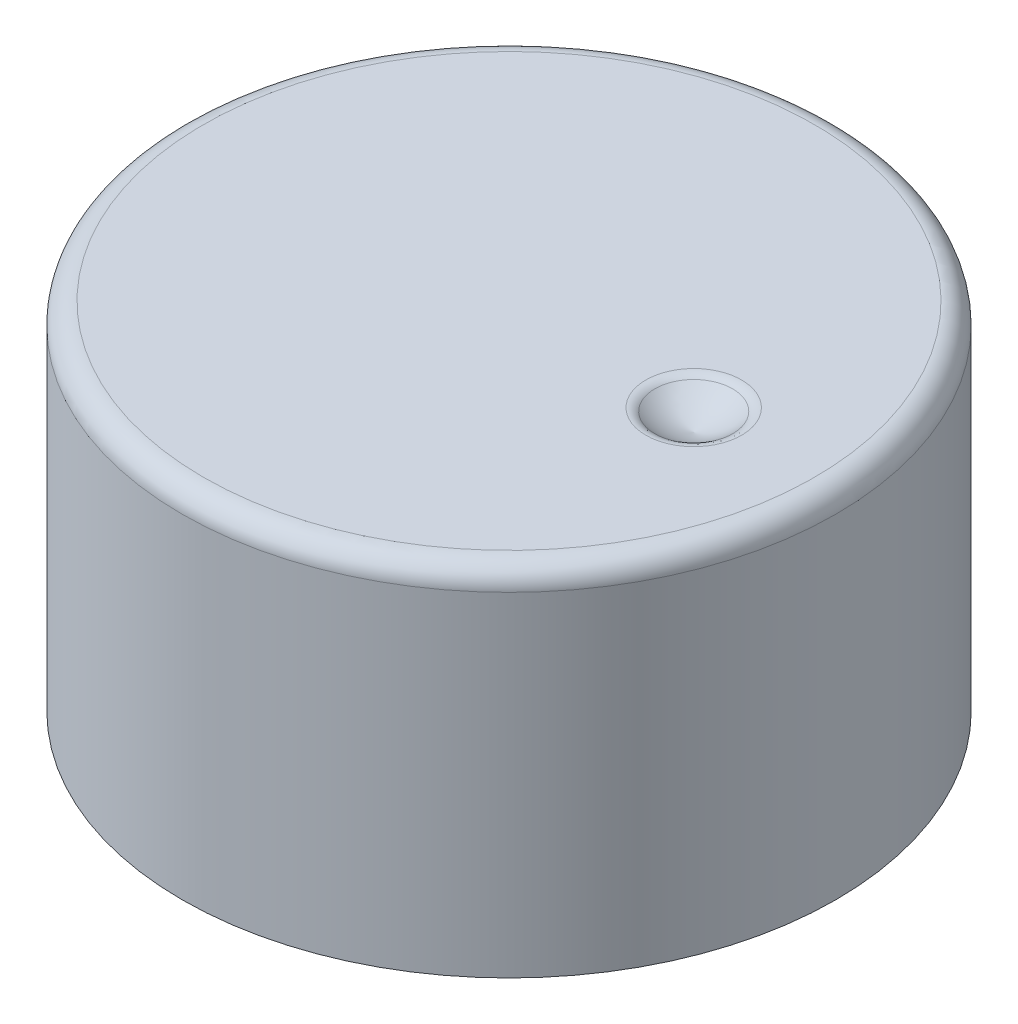
from build123d import *

# Parameters (mm, degrees)
SKETCH1_R           = 23
BOSS_EXTRUDE1_DEPTH = 25
CUT_EXTRUDE1_DEPTH  = 23
SKETCH4_R           = 10
CUT_EXTRUDE2_DEPTH  = 12
CHAMFER1_SIZE       = 10
CHAMFER1_SIZE2      = 11.917535926
FILLET1_R           = 1.5
FILLET2_R           = 1


with BuildPart() as part:
    # Sketch1 → Boss-Extrude1 (new body)
    with BuildSketch(Plane(origin=(0, 0, 0), x_dir=(1, 0, 0), z_dir=(0, 1, 0))):
        with Locations(Location((0, 0, 0), (0, 0, 270))):
            Circle(SKETCH1_R)
    extrude(amount=BOSS_EXTRUDE1_DEPTH)

    # Sketch3 → Cut-Extrude1 (cut)
    with BuildSketch(Plane(origin=(0, 0, 0), x_dir=(-1, 0, 0), z_dir=(0, -1, 0))):
        with BuildLine():
            Line((-0.45, -3.067164815), (-0.45, 3.067164815))
            ThreePointArc((-0.45, 3.067164815), (-3.1, 0), (-0.45, -3.067164815))
        make_face()
        with BuildLine():
            ThreePointArc((3.1, 0), (2.345740821, 2.02669682), (0.45, 3.067164815))
            Line((0.45, 3.067164815), (0.45, -3.067164815))
            ThreePointArc((0.45, -3.067164815), (2.345740821, -2.02669682), (3.1, 0))
        make_face()
    extrude(amount=-CUT_EXTRUDE1_DEPTH, mode=Mode.SUBTRACT)

    # Sketch4 → Cut-Extrude2 (cut)
    with BuildSketch(Plane(origin=(0, 0, 0), x_dir=(-1, 0, 0), z_dir=(0, -1, 0))):
        with Locations(Location((0, 0, 0), (0, 0, 90))):
            Circle(SKETCH4_R)
    extrude(amount=-CUT_EXTRUDE2_DEPTH, mode=Mode.SUBTRACT)

    # Chamfer1
    chamfer1_edges = [part.edges().sort_by_distance(p)[0] for p in [
        (0, 0, 10),
    ]]
    chamfer1_side = [part.faces().sort_by_distance(p)[0] for p in [
        (0, 0, -22.349461761),
    ]]
    chamfer(chamfer1_edges, length=CHAMFER1_SIZE, length2=CHAMFER1_SIZE2, reference=chamfer1_side[0])

    # Fillet1
    fillet1_edges = [part.edges().sort_by_distance(p)[0] for p in [
        (0, 25, -23),
    ]]
    fillet(fillet1_edges, radius=FILLET1_R)

    # Sketch5 → Cut-Revolve1 (revolve, cut)
    with BuildSketch(Plane.XY):
        with BuildLine():
            Line((13, 25), (13, 23.5))
            ThreePointArc((13, 23.5), (14.60360392, 24.042792159), (16, 25))
            Line((16, 25), (13, 25))
        make_face()
    revolve(axis=Axis((13, 25, 0), (0, -1, 0)), mode=Mode.SUBTRACT)

    # Fillet2
    fillet2_edges = [part.edges().sort_by_distance(p)[0] for p in [
        (10, 25, 0),
    ]]
    fillet(fillet2_edges, radius=FILLET2_R)


solid = part.part
